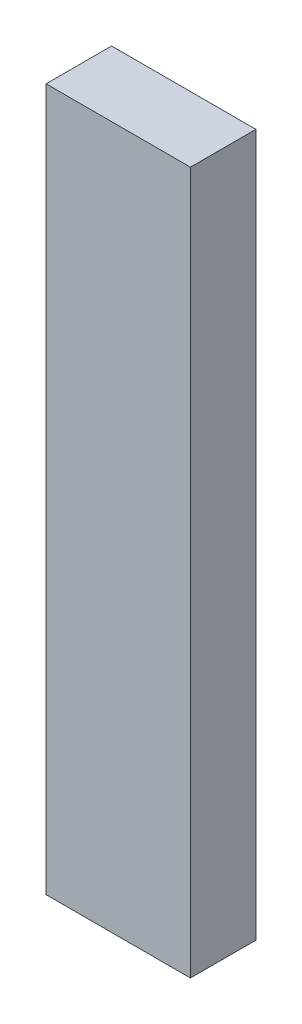
from build123d import *

# Parameters (mm, degrees)
SKETCH1_W           = 54
SKETCH1_H           = 24.5
BOSS_EXTRUDE1_DEPTH = 262.7


with BuildPart() as part:
    # Sketch1 → Boss-Extrude1 (new body)
    with BuildSketch(Plane(origin=(0, 0, 0), x_dir=(1, 0, 0), z_dir=(0, 1, 0))):
        with Locations((27, 12.25)):
            Rectangle(SKETCH1_W, SKETCH1_H)
    extrude(amount=BOSS_EXTRUDE1_DEPTH)


solid = part.part
